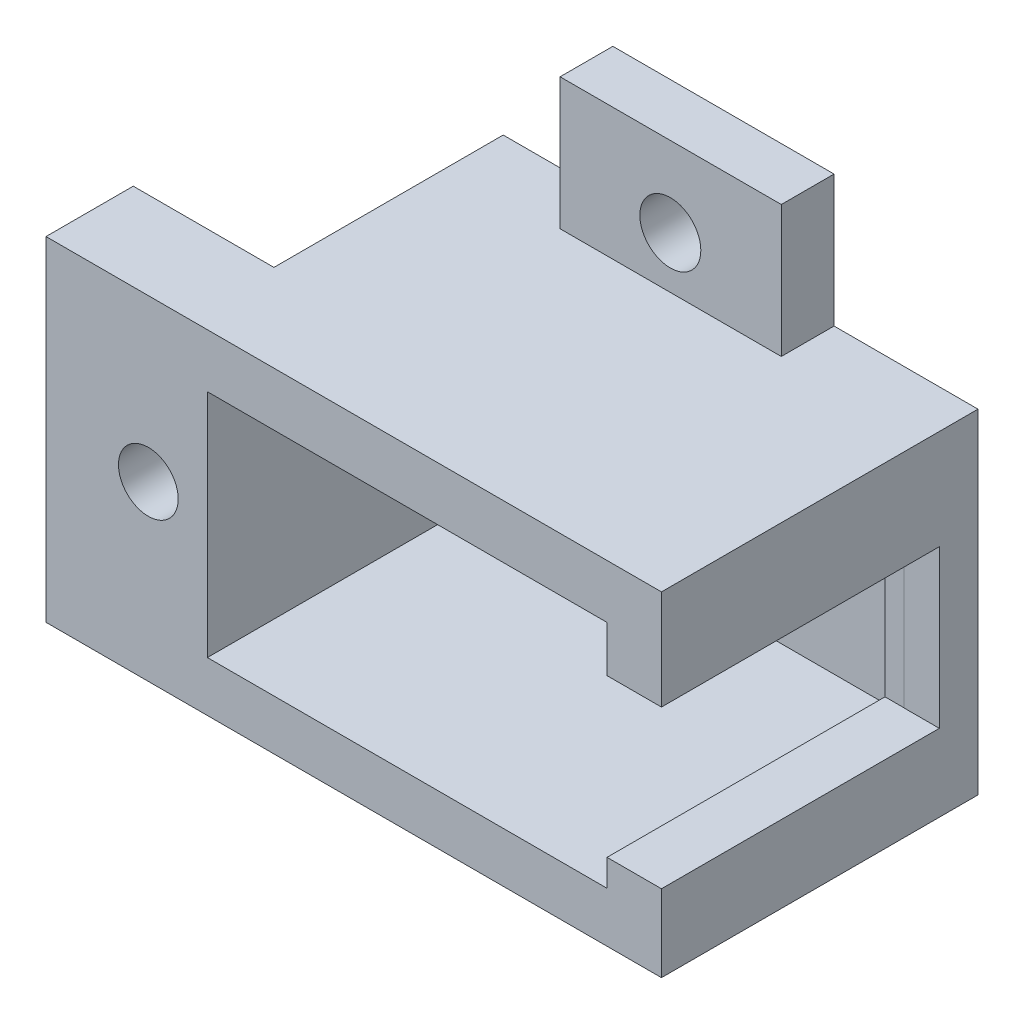
from build123d import *

# Parameters (mm, degrees)
SKETCH1_W            = 2.5
SKETCH1_H            = 1.5
BOSS_EXTRUDE1_DEPTH  = 1.8
SKETCH2_W            = 2.272709172
SKETCH2_H            = 1.309335963
CUT_EXTRUDE1_DEPTH   = 1.7
SKETCH3_W            = 0.001965442
SKETCH3_H            = 0.00266433
SKETCH3_W_2          = 1.44909182
SKETCH3_H_2          = 0.895759853
CUT_EXTRUDE2_DEPTH   = 1.8
SCALE1_SCALE         = 10
SKETCH6_W            = 3.399300392
SKETCH6_H            = 8.946780682
CUT_EXTRUDE4_DEPTH   = 10
SKETCH12_W           = 4.961896536
SKETCH12_H           = 15
BOSS_EXTRUDE5_DEPTH  = 8
SKETCH13_R           = 1.698754484
CUT_EXTRUDE6_DEPTH   = 34
SKETCH22_W           = 12.579678002
SKETCH22_H           = 9.485518979
BOSS_EXTRUDE10_DEPTH = 3
SKETCH25_R           = 1.733474482
CUT_EXTRUDE7_DEPTH   = 36
SKETCH26_W           = 6.246850144
SKETCH26_H           = 18
BOSS_EXTRUDE11_DEPTH = 2
SKETCH27_W           = 6.994524045
SKETCH27_H           = 18
BOSS_EXTRUDE12_DEPTH = 2
SKETCH28_W           = 11.770540317
SKETCH28_H           = 15
BOSS_EXTRUDE13_DEPTH = 2
SKETCH29_W           = 7.549452405
SKETCH29_H           = 18
BOSS_EXTRUDE14_DEPTH = 2
SKETCH30_W           = 6.149592849
SKETCH30_H           = 18
BOSS_EXTRUDE15_DEPTH = 2
SKETCH31_W           = 11.265161235
SKETCH31_H           = 15
BOSS_EXTRUDE16_DEPTH = 2
SKETCH32_W           = 8
SKETCH32_H           = 4.961896536
BOSS_EXTRUDE17_DEPTH = 2
SKETCH33_W           = 0.035793511
SKETCH33_H           = 18
BOSS_EXTRUDE18_DEPTH = 2
SKETCH34_W           = 8
SKETCH34_H           = 4.961896536
BOSS_EXTRUDE19_DEPTH = 2
SKETCH36_W           = 18
SKETCH36_H           = 4.317479632
BOSS_EXTRUDE20_DEPTH = 2
SKETCH37_W           = 18
SKETCH37_H           = 5.630697462
BOSS_EXTRUDE21_DEPTH = 2
SKETCH38_W           = 2.199407661
SKETCH38_H           = 9.051822906
BOSS_EXTRUDE22_DEPTH = 2
SKETCH39_W           = 15.800592339
SKETCH39_H           = 0.042851216
BOSS_EXTRUDE23_DEPTH = 2
SKETCH40_W           = 15.800592339
SKETCH40_H           = 0.062191008
BOSS_EXTRUDE24_DEPTH = 2


with BuildPart() as part:
    # Sketch1 → Boss-Extrude1 (new body)
    with BuildSketch(Plane.XY):
        with Locations((0.15674366, 0.085055811)):
            Rectangle(SKETCH1_W, SKETCH1_H)
    extrude(amount=BOSS_EXTRUDE1_DEPTH)

    # Sketch2 → Cut-Extrude1 (cut)
    with BuildSketch(Plane.XY.offset(1.8)):
        with Locations((0.160861454, 0.075181403)):
            Rectangle(SKETCH2_W, SKETCH2_H)
    extrude(amount=-CUT_EXTRUDE1_DEPTH, mode=Mode.SUBTRACT)

    # Sketch3 → Cut-Extrude2 (cut)
    with BuildSketch(Plane(origin=(1.40674366, 0, 0), x_dir=(0, 0, -1), z_dir=(1, 0, 0))):
        with Locations((-0.29122496, -0.460339146)):
            Rectangle(SKETCH3_W, SKETCH3_H)
        with Locations((-0.943862586, 0.020902802)):
            Rectangle(SKETCH3_W_2, SKETCH3_H_2)
    extrude(amount=-CUT_EXTRUDE2_DEPTH, mode=Mode.SUBTRACT)


with BuildPart() as part_1:
    # Scale1: scaled about (0.033599126, 0.123190455, 0.732690955)
    add(part.part.scale(SCALE1_SCALE).moved(Location((-0.302392134, -1.108714095, -6.594218595))))

    # Sketch6 → Cut-Extrude4 (cut)
    with BuildSketch(Plane(origin=(13.765044467, 0, 0), x_dir=(0, 0, -1), z_dir=(1, 0, 0))):
        with Locations((-11.016576897, -0.905094997)):
            Rectangle(SKETCH6_W, SKETCH6_H)
    extrude(amount=-CUT_EXTRUDE4_DEPTH, mode=Mode.SUBTRACT)

    # Sketch12 → Boss-Extrude5 (add)
    with BuildSketch(Plane.ZY.offset(11.234955533)):
        with Locations((8.924833137, -0.258155978)):
            Rectangle(SKETCH12_W, SKETCH12_H)
    extrude(amount=BOSS_EXTRUDE5_DEPTH)

    # Sketch13 → Cut-Extrude6 (cut)
    with BuildSketch(Plane.XY.offset(11.405781405)):
        with Locations((-13.415722705, 0.071814751)):
            Circle(SKETCH13_R)
    extrude(amount=-CUT_EXTRUDE6_DEPTH, mode=Mode.SUBTRACT)

    # Sketch22 → Boss-Extrude10 (add)
    with BuildSketch(Plane(origin=(0, 0, -6.594218595), x_dir=(-1, 0, 0), z_dir=(0, 0, -1))):
        with Locations((-1.289819106, 11.984603512)):
            Rectangle(SKETCH22_W, SKETCH22_H)
        with Locations((-1.289819106, -12.500915468)):
            Rectangle(SKETCH22_W, SKETCH22_H)
    extrude(amount=-BOSS_EXTRUDE10_DEPTH)

    # Sketch25 → Cut-Extrude7 (cut)
    with BuildSketch(Plane.XY.offset(-3.594218595)):
        with Locations((1.268574204, 12.179653892)):
            Circle(SKETCH25_R)
        with Locations((1.268574204, -12.893454026)):
            Circle(SKETCH25_R)
    extrude(amount=-CUT_EXTRUDE7_DEPTH, mode=Mode.SUBTRACT)

    # Sketch26 → Boss-Extrude11 (add)
    with BuildSketch(Plane(origin=(0, 7.241844022, 0), x_dir=(1, 0, 0), z_dir=(0, 1, 0))):
        with Locations((-8.111530461, -2.405781405)):
            Rectangle(SKETCH26_W, SKETCH26_H)
    extrude(amount=BOSS_EXTRUDE11_DEPTH)

    # Sketch27 → Boss-Extrude12 (add)
    with BuildSketch(Plane(origin=(0, 7.241844022, 0), x_dir=(1, 0, 0), z_dir=(0, 1, 0))):
        with Locations((10.267782444, -2.405781405)):
            Rectangle(SKETCH27_W, SKETCH27_H)
    extrude(amount=BOSS_EXTRUDE12_DEPTH)

    # Sketch28 → Boss-Extrude13 (add)
    with BuildSketch(Plane(origin=(0, 7.241844022, 0), x_dir=(1, 0, 0), z_dir=(0, 1, 0))):
        with Locations((0.885250264, -3.905781405)):
            Rectangle(SKETCH28_W, SKETCH28_H)
    extrude(amount=BOSS_EXTRUDE13_DEPTH)

    # Sketch29 → Boss-Extrude14 (add)
    with BuildSketch(Plane(origin=(0, -7.758155978, 0), x_dir=(-1, 0, 0), z_dir=(0, -1, 0))):
        with Locations((7.460229331, -2.405781405)):
            Rectangle(SKETCH29_W, SKETCH29_H)
    extrude(amount=BOSS_EXTRUDE14_DEPTH)

    # Sketch30 → Boss-Extrude15 (add)
    with BuildSketch(Plane(origin=(0, -7.758155978, 0), x_dir=(-1, 0, 0), z_dir=(0, -1, 0))):
        with Locations((-10.690248043, -2.405781405)):
            Rectangle(SKETCH30_W, SKETCH30_H)
    extrude(amount=BOSS_EXTRUDE15_DEPTH)

    # Sketch31 → Boss-Extrude16 (add)
    with BuildSketch(Plane.XZ.offset(7.758155978)):
        with Locations((1.94707749, 3.905781405)):
            Rectangle(SKETCH31_W, SKETCH31_H)
    extrude(amount=BOSS_EXTRUDE16_DEPTH)

    # Sketch32 → Boss-Extrude17 (add)
    with BuildSketch(Plane(origin=(0, 7.241844022, 0), x_dir=(1, 0, 0), z_dir=(0, 1, 0))):
        with Locations((-15.234955533, -8.924833137)):
            Rectangle(SKETCH32_W, SKETCH32_H)
    extrude(amount=BOSS_EXTRUDE17_DEPTH)

    # Sketch33 → Boss-Extrude18 (add)
    with BuildSketch(Plane(origin=(0, -7.758155978, 0), x_dir=(-1, 0, 0), z_dir=(0, -1, 0))):
        with Locations((-7.597554863, -2.405781405)):
            Rectangle(SKETCH33_W, SKETCH33_H)
    extrude(amount=BOSS_EXTRUDE18_DEPTH)

    # Sketch34 → Boss-Extrude19 (add)
    with BuildSketch(Plane.XZ.offset(7.758155978)):
        with Locations((-15.234955533, 8.924833137)):
            Rectangle(SKETCH34_W, SKETCH34_H)
    extrude(amount=BOSS_EXTRUDE19_DEPTH)

    # Sketch36 → Boss-Extrude20 (add)
    with BuildSketch(Plane(origin=(13.765044467, 0, 0), x_dir=(0, 0, -1), z_dir=(1, 0, 0))):
        with Locations((-2.405781405, -7.599416162)):
            Rectangle(SKETCH36_W, SKETCH36_H)
    extrude(amount=BOSS_EXTRUDE20_DEPTH)

    # Sketch37 → Boss-Extrude21 (add)
    with BuildSketch(Plane(origin=(13.765044467, 0, 0), x_dir=(0, 0, -1), z_dir=(1, 0, 0))):
        with Locations((-2.405781405, 6.426495291)):
            Rectangle(SKETCH37_W, SKETCH37_H)
    extrude(amount=BOSS_EXTRUDE21_DEPTH)

    # Sketch38 → Boss-Extrude22 (add)
    with BuildSketch(Plane(origin=(13.765044467, 0, 0), x_dir=(0, 0, -1), z_dir=(1, 0, 0))):
        with Locations((5.494514764, -0.914764893)):
            Rectangle(SKETCH38_W, SKETCH38_H)
    extrude(amount=BOSS_EXTRUDE22_DEPTH)

    # Sketch39 → Boss-Extrude23 (add)
    with BuildSketch(Plane(origin=(13.765044467, 0, 0), x_dir=(0, 0, -1), z_dir=(1, 0, 0))):
        with Locations((-3.505485236, 3.589720952)):
            Rectangle(SKETCH39_W, SKETCH39_H)
    extrude(amount=BOSS_EXTRUDE23_DEPTH)

    # Sketch40 → Boss-Extrude24 (add)
    with BuildSketch(Plane(origin=(13.765044467, 0, 0), x_dir=(0, 0, -1), z_dir=(1, 0, 0))):
        with Locations((-3.505485236, -5.409580842)):
            Rectangle(SKETCH40_W, SKETCH40_H)
    extrude(amount=BOSS_EXTRUDE24_DEPTH)


solid = part_1.part
